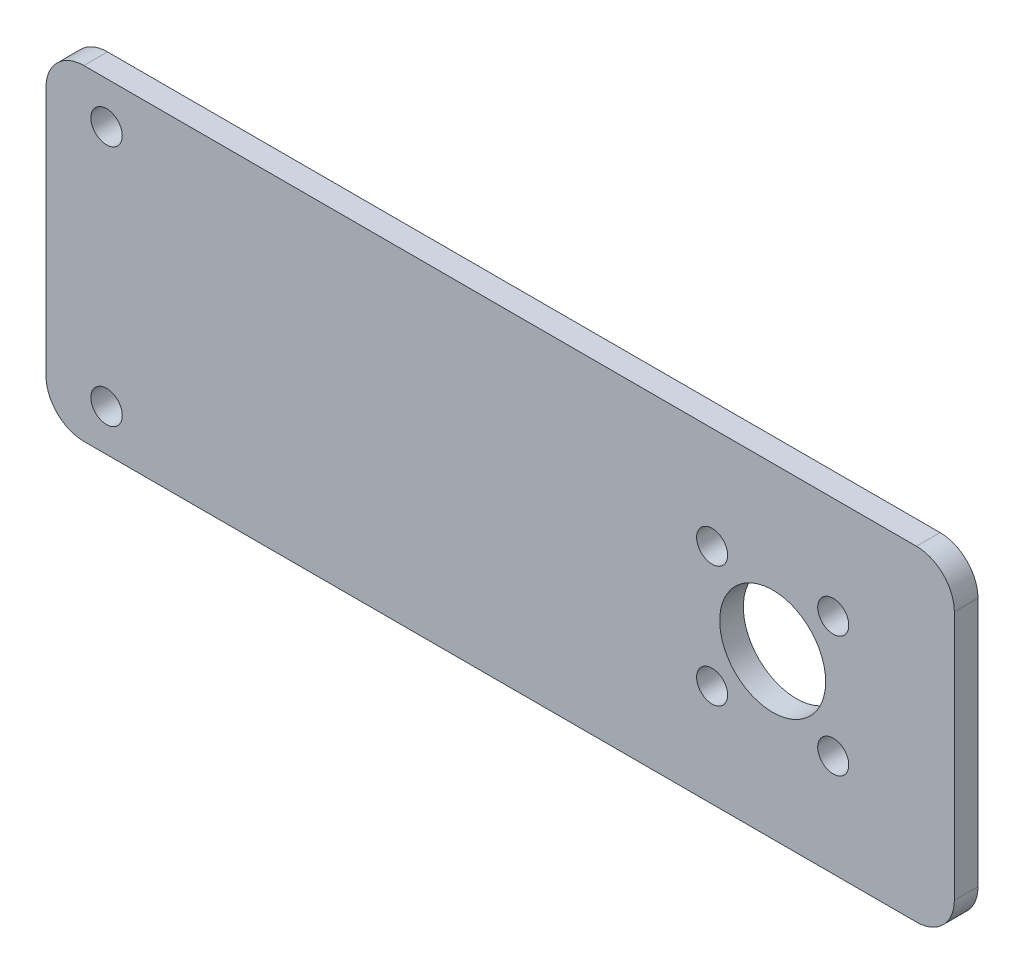
from build123d import *

# Parameters (mm, degrees)
SKETCH1_W           = 120
SKETCH1_H           = 43
SKETCH1_R           = 2.075
SKETCH1_R_2         = 2.05
SKETCH1_R_3         = 7
BOSS_EXTRUDE1_DEPTH = 3.125
FILLET1_R           = 5


with BuildPart() as part:
    # Sketch1 → Boss-Extrude1 (new body)
    with BuildSketch(Plane.XY):
        Rectangle(SKETCH1_W, SKETCH1_H)
        with Locations((-52, 16)):
            Circle(SKETCH1_R, mode=Mode.SUBTRACT)
        with Locations((-52, -16)):
            Circle(SKETCH1_R, mode=Mode.SUBTRACT)
        with Locations((28, 8)):
            Circle(SKETCH1_R_2, mode=Mode.SUBTRACT)
        with Locations((44, 8)):
            Circle(SKETCH1_R_2, mode=Mode.SUBTRACT)
        with Locations((44, -8)):
            Circle(SKETCH1_R_2, mode=Mode.SUBTRACT)
        with Locations((36, 0)):
            Circle(SKETCH1_R_3, mode=Mode.SUBTRACT)
        with Locations((28, -8)):
            Circle(SKETCH1_R_2, mode=Mode.SUBTRACT)
    extrude(amount=BOSS_EXTRUDE1_DEPTH)

    # Fillet1
    fillet1_edges = [part.edges().sort_by_distance(p)[0] for p in [
        (-60, 21.5, 1.5625),
        (60, 21.5, 1.5625),
        (60, -21.5, 1.5625),
        (-60, -21.5, 1.5625),
    ]]
    fillet(fillet1_edges, radius=FILLET1_R)


solid = part.part
